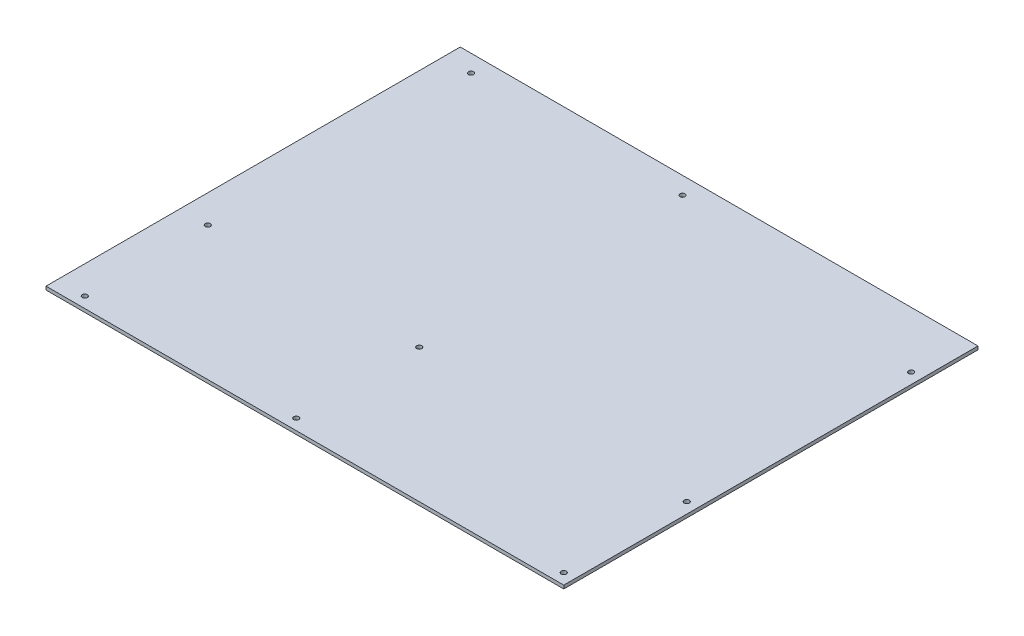
from build123d import *

# Parameters (mm, degrees)
SKETCH_1_W          = 304.8
SKETCH_1_H          = 243.84
EXTRUDE_1_DEPTH     = 2
SKETCH_2_R          = 1.5
CUT_EXTRUDE_1_DEPTH = 391.339577291


with BuildPart() as part:
    # Эскиз1 → Бобышка-Вытянуть1 (new body)
    with BuildSketch(Plane(origin=(0, 0, 0), x_dir=(1, 0, 0), z_dir=(0, 1, 0))):
        with Locations((152.4, 121.92)):
            Rectangle(SKETCH_1_W, SKETCH_1_H)
    extrude(amount=EXTRUDE_1_DEPTH)

    # Эскиз2 → Вырез-Вытянуть1 (cut, through all)
    with BuildSketch(Plane(origin=(0, 2, 0), x_dir=(1, 0, 0), z_dir=(0, 1, 0))):
        with Locations(Location((16.51, 6.35, 0), (0, 0, 270))):
            Circle(SKETCH_2_R)
        with Locations(Location((140.97, 6.35, 0), (0, 0, 270))):
            Circle(SKETCH_2_R)
        with Locations(Location((298.45, 6.35, 0), (0, 0, 270))):
            Circle(SKETCH_2_R)
        with Locations(Location((298.45, 78.74, 0), (0, 0, 270))):
            Circle(SKETCH_2_R)
        with Locations(Location((140.97, 78.74, 0), (0, 0, 270))):
            Circle(SKETCH_2_R)
        with Locations(Location((16.51, 78.74, 0), (0, 0, 270))):
            Circle(SKETCH_2_R)
        with Locations(Location((16.51, 233.68, 0), (0, 0, 270))):
            Circle(SKETCH_2_R)
        with Locations(Location((140.97, 233.68, 0), (0, 0, 270))):
            Circle(SKETCH_2_R)
        with Locations(Location((298.45, 210.82, 0), (0, 0, 270))):
            Circle(SKETCH_2_R)
    extrude(amount=-CUT_EXTRUDE_1_DEPTH, mode=Mode.SUBTRACT)


solid = part.part
